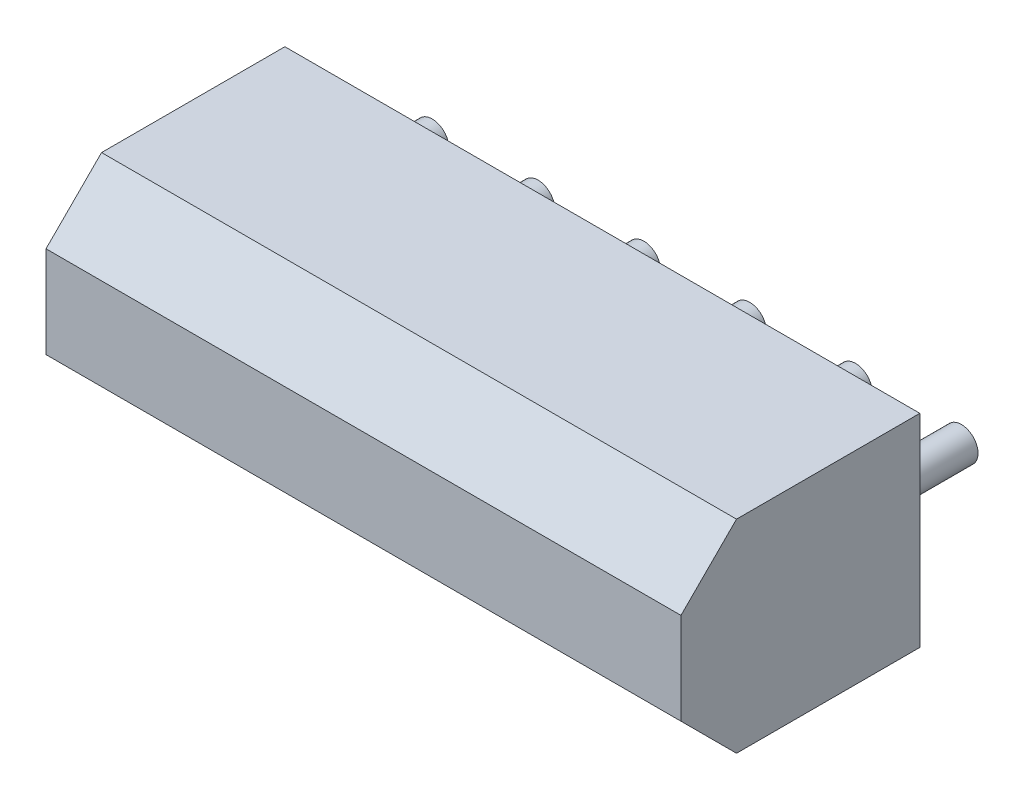
from build123d import *

# Parameters (mm, degrees)
SKETCH_1_W                 = 22.86
SKETCH_1_H                 = 7.3
EXTRUDE_1_DEPTH            = 8.6
CHAMFER_1_SIZE             = 2
SKETCH_2_W                 = 1.5
SKETCH_2_H                 = 2.244760595
CUT_EXTRUDE_1_DEPTH        = 0.5
PATTERN_LINEAR_1_COUNT     = 3
PATTERN_LINEAR_1_PITCH     = 3.81
PATTERN_LINEAR_1_COL_COUNT = 4
PATTERN_LINEAR_1_COL_PITCH = 3.81
SKETCH_3_R                 = 0.6
EXTRUDE_2_DEPTH            = 3.4
PATTERN_LINEAR_2_COUNT     = 4
PATTERN_LINEAR_2_PITCH     = 3.81
PATTERN_LINEAR_2_COL_COUNT = 3
PATTERN_LINEAR_2_COL_PITCH = 3.81
PATTERN_LINEAR_3_COUNT     = 2
PATTERN_LINEAR_3_PITCH     = 3.81


with BuildPart() as part:
    # 草图1 → 凸台-拉伸1 (new body)
    with BuildSketch(Plane.XY):
        with Locations((11.43, 3.65)):
            Rectangle(SKETCH_1_W, SKETCH_1_H)
    extrude(amount=EXTRUDE_1_DEPTH)

    # 倒角1
    chamfer_1_edges = [part.edges().sort_by_distance(p)[0] for p in [
        (11.43, 7.3, 8.6),
        (11.43, 0, 8.6),
    ]]
    chamfer(chamfer_1_edges, length=CHAMFER_1_SIZE)

    # 草图2 → 切除-拉伸1 (cut)
    with BuildSketch(Plane.XZ):
        with Locations((13.335, 3.602057757)):
            Rectangle(SKETCH_2_W, SKETCH_2_H)
    cut_extrude_1 = extrude(amount=-CUT_EXTRUDE_1_DEPTH, mode=Mode.SUBTRACT)

    # 阵列(线性)1: 切除-拉伸1 ×3
    with Locations(*[(i * PATTERN_LINEAR_1_PITCH, 0, 0) for i in range(1, PATTERN_LINEAR_1_COUNT)]):
        add(cut_extrude_1, mode=Mode.SUBTRACT)

    # 阵列(线性)1 col: 切除-拉伸1 ×4
    with Locations(*[(-i * PATTERN_LINEAR_1_COL_PITCH, 0, 0) for i in range(1, PATTERN_LINEAR_1_COL_COUNT)]):
        add(cut_extrude_1, mode=Mode.SUBTRACT)

    # 草图3 → 凸台-拉伸2 (add)
    with BuildSketch(Plane(origin=(0, 0, 0), x_dir=(-1, 0, 0), z_dir=(0, 0, -1))):
        with Locations((-13.335, 3.7)):
            Circle(SKETCH_3_R)
    extrude_2 = extrude(amount=EXTRUDE_2_DEPTH)

    # 阵列(线性)2: 凸台-拉伸2 ×4
    with Locations(*[(-i * PATTERN_LINEAR_2_PITCH, 0, 0) for i in range(1, PATTERN_LINEAR_2_COUNT)]):
        add(extrude_2)

    # 阵列(线性)2 col: 凸台-拉伸2 ×3
    with Locations(*[(i * PATTERN_LINEAR_2_COL_PITCH, 0, 0) for i in range(1, PATTERN_LINEAR_2_COL_COUNT)]):
        add(extrude_2)

    # 阵列(线性)3: 凸台-拉伸2 ×2
    with Locations(*[(-i * PATTERN_LINEAR_3_PITCH, 0, 0) for i in range(1, PATTERN_LINEAR_3_COUNT)]):
        add(extrude_2)


solid = part.part
